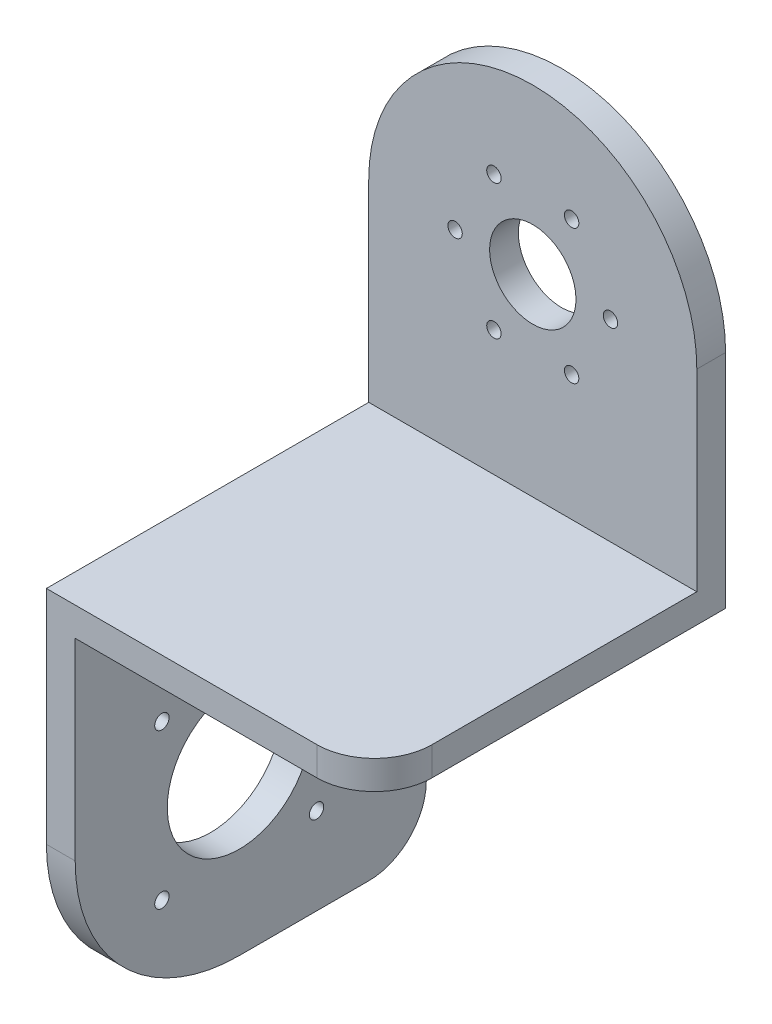
from build123d import *

# Parameters (mm, degrees)
EXTRUDE_1_DEPTH          = 61
SKETCH_3_W               = 5
SKETCH_3_H               = 62
EXTRUDE_2_DEPTH          = 57
CUT_EXTRUDE_11_DEPTH     = 10
SKETCH_16_R              = 7.5
SKETCH_16_R_2            = 1.25
CUT_EXTRUDE_12_DEPTH     = 10
PATTERN_CIRCULAR_7_COUNT = 6
CUT_EXTRUDE_13_DEPTH     = 10
FILLET_2_R               = 10
SKETCH_18_R              = 12.5
SKETCH_18_R_2            = 1.25
CUT_EXTRUDE_14_DEPTH     = 10
PATTERN_CIRCULAR_8_COUNT = 4


with BuildPart() as part:
    # 草图1 → 凸台-拉伸1 (new body)
    with BuildSketch(Plane.XY):
        Polygon((0, 0), (57, 0), (57, -5), (5, -5), (5, -67), (0, -67), (0, -10.157289975), align=None)
    extrude(amount=EXTRUDE_1_DEPTH)

    # 草图3 → 凸台-拉伸2 (add)
    with BuildSketch(Plane.ZY):
        with Locations((2.5, 31)):
            Rectangle(SKETCH_3_W, SKETCH_3_H)
    extrude(amount=-EXTRUDE_2_DEPTH)

    # 草图15 → 切除-拉伸11 (cut)
    with BuildSketch(Plane(origin=(0, 0, 0), x_dir=(-1, 0, 0), z_dir=(0, 0, -1))):
        with BuildLine():
            ThreePointArc((-57, 33.5), (-48.652543264, 53.652543264), (-28.5, 62))
            Line((-28.5, 62), (-57, 62))
            Line((-57, 62), (-57, 33.5))
        make_face()
        with BuildLine():
            Line((0, 33.5), (0, 62))
            Line((0, 62), (-28.5, 62))
            ThreePointArc((-28.5, 62), (-8.347456736, 53.652543264), (0, 33.5))
        make_face()
    extrude(amount=-CUT_EXTRUDE_11_DEPTH, mode=Mode.SUBTRACT)

    # 草图16 → 切除-拉伸12 (cut)
    with BuildSketch(Plane(origin=(0, 0, 0), x_dir=(-1, 0, 0), z_dir=(0, 0, -1))):
        with Locations((-28.5, 33.5)):
            Circle(SKETCH_16_R)
        with Locations((-15, 33.5)):
            Circle(SKETCH_16_R_2)
    cut_extrude_12 = extrude(amount=-CUT_EXTRUDE_12_DEPTH, mode=Mode.SUBTRACT)

    # 阵列(圆周)7: 切除-拉伸12 ×6 about axis
    pattern_circular_7_axis = Axis((28.5, 33.5, 0), (0, 0, 1))
    for i in range(1, PATTERN_CIRCULAR_7_COUNT):
        add(cut_extrude_12.rotate(pattern_circular_7_axis, i * 360 / PATTERN_CIRCULAR_7_COUNT), mode=Mode.SUBTRACT)

    # 草图17 → 切除-拉伸13 (cut)
    with BuildSketch(Plane(origin=(5, 0, 0), x_dir=(0, 0, -1), z_dir=(1, 0, 0))):
        with BuildLine():
            Line((-61, -38.5), (-61, -67))
            Line((-61, -67), (-32.5, -67))
            ThreePointArc((-32.5, -67), (-52.652543264, -58.652543264), (-61, -38.5))
        make_face()
    extrude(amount=-CUT_EXTRUDE_13_DEPTH, mode=Mode.SUBTRACT)

    # 圆角2
    fillet_2_edges = [part.edges().sort_by_distance(p)[0] for p in [
        (57, -2.5, 61),
        (2.5, -67, 0),
    ]]
    fillet(fillet_2_edges, radius=FILLET_2_R)

    # 草图18 → 切除-拉伸14 (cut)
    with BuildSketch(Plane(origin=(5, 0, 0), x_dir=(0, 0, -1), z_dir=(1, 0, 0))):
        with Locations(Location((-32.5, -38.5, 0), (0, 0, 90))):
            Circle(SKETCH_18_R)
        with Locations(Location((-45.935028843, -51.935028843, 0), (0, 0, 90))):
            Circle(SKETCH_18_R_2)
    cut_extrude_14 = extrude(amount=-CUT_EXTRUDE_14_DEPTH, mode=Mode.SUBTRACT)

    # 阵列(圆周)8: 切除-拉伸14 ×4 about axis
    pattern_circular_8_axis = Axis((0, -38.5, 32.5), (1, 0, 0))
    for i in range(1, PATTERN_CIRCULAR_8_COUNT):
        add(cut_extrude_14.rotate(pattern_circular_8_axis, i * 360 / PATTERN_CIRCULAR_8_COUNT), mode=Mode.SUBTRACT)


solid = part.part
